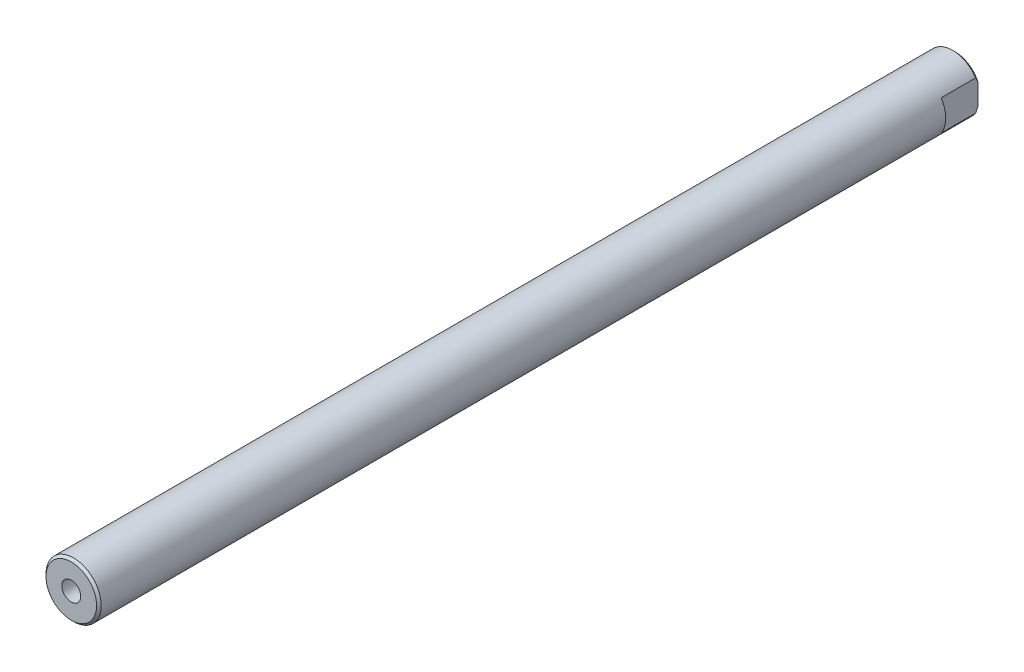
from build123d import *

# Parameters (mm, degrees)
SKETCH1_R                    = 9.525
EXTRUDE1_DEPTH               = 304.8
CHAMFER1_SIZE                = 0.79375
F_5_16_18_TAPPED_HOLE1_D     = 6.5278
F_5_16_18_TAPPED_HOLE1_DEPTH = 24.6063008
F_5_16_18_TAPPED_HOLE1_TIP   = 1.961148974
CUT_EXTRUDE1_DEPTH           = 12.7


with BuildPart() as part:
    # Sketch1 → Extrude1 (new body)
    with BuildSketch(Plane.XY):
        with Locations(Location((0, 0, 0), (0, 0, 180))):
            Circle(SKETCH1_R)
    extrude(amount=EXTRUDE1_DEPTH)

    # Chamfer1
    chamfer1_edges = [part.edges().sort_by_distance(p)[0] for p in [
        (9.525, 0, 0),
        (9.525, 0, 304.8),
    ]]
    chamfer(chamfer1_edges, length=CHAMFER1_SIZE)

    # 5/16-18 Tapped Hole1
    with Locations(Plane.XY.offset(304.8)):
        with Locations((0, 0)):
            Hole(F_5_16_18_TAPPED_HOLE1_D / 2, depth=F_5_16_18_TAPPED_HOLE1_DEPTH)
            with Locations((0, 0, -(F_5_16_18_TAPPED_HOLE1_DEPTH + F_5_16_18_TAPPED_HOLE1_TIP / 2))):  # 118° drill point
                Cone(0, F_5_16_18_TAPPED_HOLE1_D / 2, F_5_16_18_TAPPED_HOLE1_TIP, mode=Mode.SUBTRACT)

    # Sketch4 → Cut-Extrude1 (cut)
    with BuildSketch(Plane(origin=(0, 0, 0), x_dir=(-1, 0, 0), z_dir=(0, 0, -1))):
        with BuildLine():
            Line((-7.9375, 5.265141855), (-7.9375, -5.265141855))
            ThreePointArc((-7.9375, -5.265141855), (-9.525, 0), (-7.9375, 5.265141855))
        make_face()
        with BuildLine():
            Line((7.9375, 5.265141855), (7.9375, -5.265141855))
            ThreePointArc((7.9375, -5.265141855), (9.525, 0), (7.9375, 5.265141855))
        make_face()
    extrude(amount=-CUT_EXTRUDE1_DEPTH, mode=Mode.SUBTRACT)


solid = part.part
